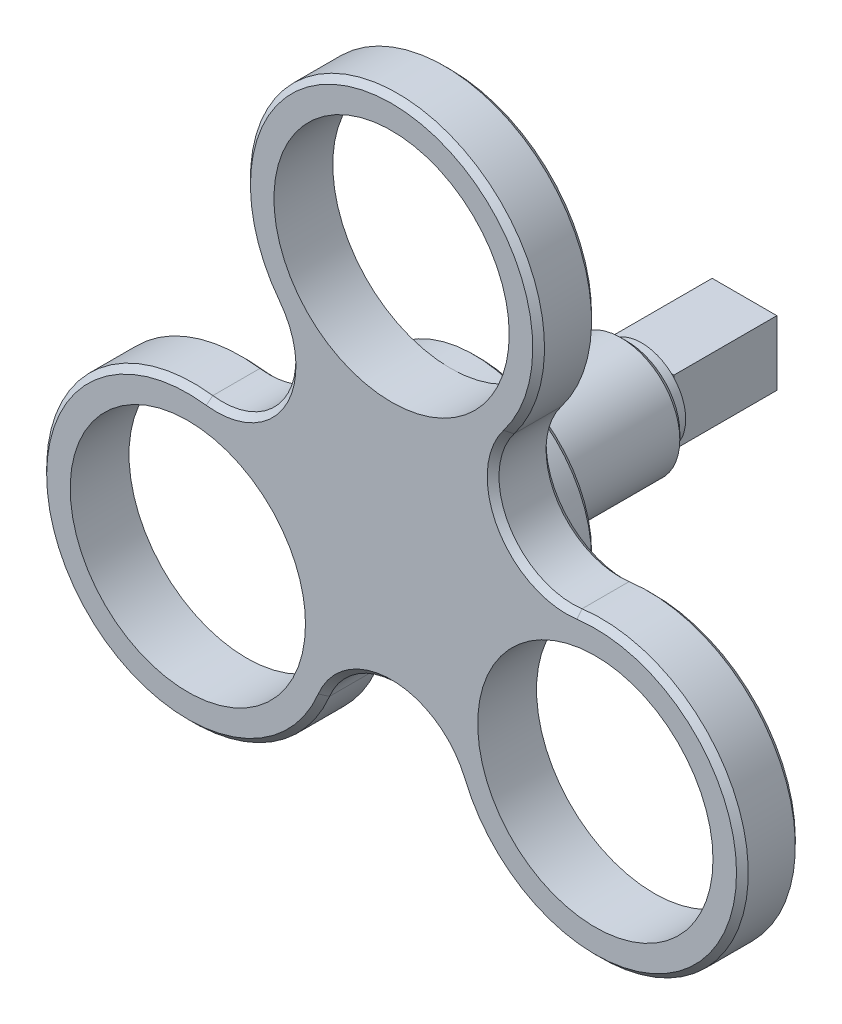
from build123d import *

# Parameters (mm, degrees)
SCHIZZO1_W                   = 2.2
SCHIZZO1_H                   = 2.2
ESTRUSIONE_ESTRUSIONE1_DEPTH = 3.5
SCHIZZO2_R                   = 1.5
ESTRUSIONE_ESTRUSIONE2_DEPTH = 0.5
SCHIZZO3_R                   = 2
ESTRUSIONE_ESTRUSIONE3_DEPTH = 5
SCHIZZO4_R                   = 4
ESTRUSIONE_ESTRUSIONE4_DEPTH = 1
SCHIZZO5_R                   = 4
ESTRUSIONE_ESTRUSIONE5_DEPTH = 2
SMUSSO1_SIZE                 = 0.2


with BuildPart() as part:
    # Schizzo1 → Estrusione-Estrusione1 (new body)
    with BuildSketch(Plane.XY):
        Rectangle(SCHIZZO1_W, SCHIZZO1_H)
    extrude(amount=ESTRUSIONE_ESTRUSIONE1_DEPTH)

    # Schizzo2 → Estrusione-Estrusione2 (add)
    with BuildSketch(Plane.XY.offset(3.5)):
        with Locations(Location((0, 0, 0), (0, 0, 137.166571934))):
            Circle(SCHIZZO2_R)
    extrude(amount=ESTRUSIONE_ESTRUSIONE2_DEPTH)

    # Schizzo3 → Estrusione-Estrusione3 (add)
    with BuildSketch(Plane.XY.offset(4)):
        Circle(SCHIZZO3_R)
    extrude(amount=ESTRUSIONE_ESTRUSIONE3_DEPTH)

    # Schizzo4 → Estrusione-Estrusione4 (add)
    with BuildSketch(Plane.XY.offset(9)):
        Circle(SCHIZZO4_R)
    extrude(amount=ESTRUSIONE_ESTRUSIONE4_DEPTH)

    # Schizzo5 → Estrusione-Estrusione5 (add)
    with BuildSketch(Plane.XY.offset(10)):
        with BuildLine():
            ThreePointArc((3.967713472, 4.957427108), (0, 13), (-3.967713472, 4.957427108))
            ThreePointArc((-3.967713472, 4.957427108), (-3.786506698, 2.186140662), (-6.277114549, 0.957427108))
            ThreePointArc((-6.277114549, 0.957427108), (-11.258330249, -6.5), (-2.309401077, -5.914854216))
            ThreePointArc((-2.309401077, -5.914854216), (0, -4.372281323), (2.309401077, -5.914854216))
            ThreePointArc((2.309401077, -5.914854216), (11.258330249, -6.5), (6.277114549, 0.957427108))
            ThreePointArc((6.277114549, 0.957427108), (3.786506698, 2.186140662), (3.967713472, 4.957427108))
        make_face()
        with Locations(Location((0, 8, 0), (0, 0, 269.999713521))):
            Circle(SCHIZZO5_R, mode=Mode.SUBTRACT)
        with Locations(Location((6.92820323, -4, 0), (0, 0, 149.999713519))):
            Circle(SCHIZZO5_R, mode=Mode.SUBTRACT)
        with Locations(Location((-6.92820323, -4, 0), (0, 0, 29.999713529))):
            Circle(SCHIZZO5_R, mode=Mode.SUBTRACT)
    extrude(amount=ESTRUSIONE_ESTRUSIONE5_DEPTH)

    # Smusso1
    smusso1_edges = [part.edges().sort_by_distance(p)[0] for p in [
        (-2, 0, 4),
        (-4, 0, 9),
        (3.786506698, 2.186140662, 12),
        (0, 13, 12),
        (-3.786506698, 2.186140662, 12),
        (-11.258330249, -6.5, 12),
        (0, -4.372281323, 12),
        (11.258330249, -6.5, 12),
        (3.786506698, 2.186140662, 10),
        (0, 13, 10),
        (-3.786506698, 2.186140662, 10),
        (-11.258330249, -6.5, 10),
        (0, -4.372281323, 10),
        (11.258330249, -6.5, 10),
    ]]
    chamfer(smusso1_edges, length=SMUSSO1_SIZE)


solid = part.part
